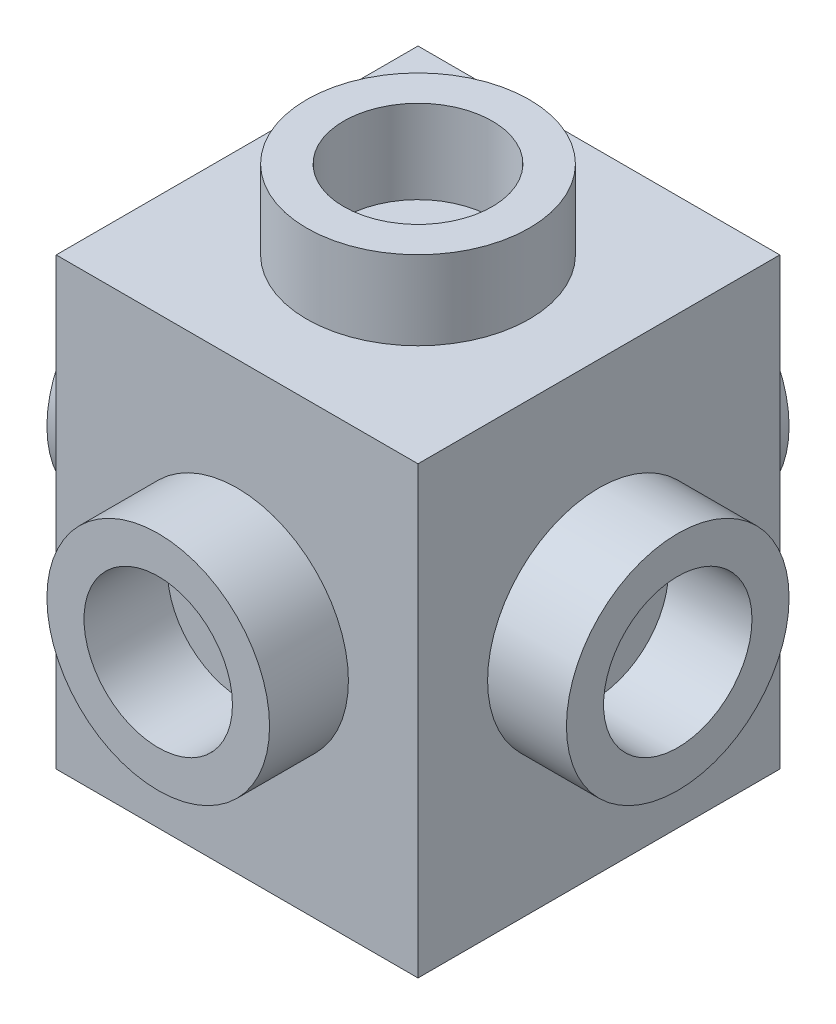
from build123d import *

# Parameters (mm, degrees)
SKETCH_1_W          = 7.8
SKETCH_1_H          = 7.8
EXTRUDE_1_DEPTH     = 9.6
SKETCH_2_R          = 2.4
EXTRUDE_2_DEPTH     = 1.7
EXTRUDE_6_DEPTH     = 1.7
EXTRUDE_7_DEPTH     = 1.7
EXTRUDE_START       = 1.7
EXTRUDE_8_DEPTH     = 1.7
EXTRUDE_9_DEPTH     = 1.7
CUT_EXTRUDE_1_DEPTH = 1.8
SKETCH_12_R         = 1.6
CUT_EXTRUDE_2_DEPTH = 1.8
SKETCH_13_R         = 1.6
CUT_EXTRUDE_3_DEPTH = 1.8
CUT_EXTRUDE_START   = -1.8
SKETCH_14_R         = 1.6
CUT_EXTRUDE_4_DEPTH = 1.8
SKETCH_15_R         = 1.6
CUT_EXTRUDE_5_DEPTH = 1.8
SKETCH_16_R         = 1.6
CUT_EXTRUDE_6_DEPTH = 1.8


with BuildPart() as part:
    # Эскиз1 → Бобышка-Вытянуть1 (new body)
    with BuildSketch(Plane(origin=(0, 0, 0), x_dir=(1, 0, 0), z_dir=(0, 1, 0))):
        Rectangle(SKETCH_1_W, SKETCH_1_H)
    extrude(amount=EXTRUDE_1_DEPTH)

    # Эскиз2 → Бобышка-Вытянуть2 (add)
    with BuildSketch(Plane(origin=(0, 9.6, 0), x_dir=(1, 0, 0), z_dir=(0, 1, 0))):
        with Locations(Location((0, 0, 0), (0, 0, 270))):
            Circle(SKETCH_2_R)
    extrude(amount=EXTRUDE_2_DEPTH)

    # Эскиз6 → Бобышка-Вытянуть6 (add)
    with BuildSketch(Plane.XY.offset(3.9)):
        with BuildLine():
            ThreePointArc((1.5134223, 6.6626736), (0, 7.2), (-1.5134223, 6.6626736))
            Line((-1.5134223, 6.6626736), (0, 4.8))
            Line((0, 4.8), (1.5134223, 6.6626736))
        make_face()
        with BuildLine():
            Line((0, 4.8), (-1.5134223, 6.6626736))
            ThreePointArc((-1.5134223, 6.6626736), (-2.4, 4.8), (-1.5134223, 2.9373264))
            Line((-1.5134223, 2.9373264), (0, 4.8))
        make_face()
        with BuildLine():
            Line((1.5134223, 6.6626736), (0, 4.8))
            Line((0, 4.8), (1.5134223, 2.9373264))
            ThreePointArc((1.5134223, 2.9373264), (2.167050244, 3.768547994), (2.4, 4.8))
            ThreePointArc((2.4, 4.8), (2.167050244, 5.831452006), (1.5134223, 6.6626736))
        make_face()
        with BuildLine():
            Line((1.5134223, 2.9373264), (0, 4.8))
            Line((0, 4.8), (-1.5134223, 2.9373264))
            ThreePointArc((-1.5134223, 2.9373264), (0, 2.4), (1.5134223, 2.9373264))
        make_face()
    extrude(amount=EXTRUDE_6_DEPTH)

    # Эскиз7 → Бобышка-Вытянуть7 (add)
    with BuildSketch(Plane(origin=(3.9, 0, 0), x_dir=(0, 0, -1), z_dir=(1, 0, 0))):
        with BuildLine():
            ThreePointArc((1.5134223, 6.6626736), (0, 7.2), (-1.5134223, 6.6626736))
            Line((-1.5134223, 6.6626736), (0, 4.8))
            Line((0, 4.8), (1.5134223, 6.6626736))
        make_face()
        with BuildLine():
            Line((0, 4.8), (-1.5134223, 6.6626736))
            ThreePointArc((-1.5134223, 6.6626736), (-2.4, 4.8), (-1.5134223, 2.9373264))
            Line((-1.5134223, 2.9373264), (0, 4.8))
        make_face()
        with BuildLine():
            Line((1.5134223, 6.6626736), (0, 4.8))
            Line((0, 4.8), (1.5134223, 2.9373264))
            ThreePointArc((1.5134223, 2.9373264), (2.167050244, 3.768547994), (2.4, 4.8))
            ThreePointArc((2.4, 4.8), (2.167050244, 5.831452006), (1.5134223, 6.6626736))
        make_face()
        with BuildLine():
            Line((1.5134223, 2.9373264), (0, 4.8))
            Line((0, 4.8), (-1.5134223, 2.9373264))
            ThreePointArc((-1.5134223, 2.9373264), (0, 2.4), (1.5134223, 2.9373264))
        make_face()
    extrude(amount=EXTRUDE_7_DEPTH)

    # Эскиз9 → Бобышка-Вытянуть8 (add)
    with BuildSketch(Plane(origin=(0, 0, -3.9), x_dir=(-1, 0, 0), z_dir=(0, 0, -1)).offset(EXTRUDE_START)):
        with BuildLine():
            ThreePointArc((1.5134223, 6.6626736), (0, 7.2), (-1.5134223, 6.6626736))
            Line((-1.5134223, 6.6626736), (0, 4.8))
            Line((0, 4.8), (1.5134223, 6.6626736))
        make_face()
        with BuildLine():
            Line((0, 4.8), (-1.5134223, 6.6626736))
            ThreePointArc((-1.5134223, 6.6626736), (-2.4, 4.8), (-1.5134223, 2.9373264))
            Line((-1.5134223, 2.9373264), (0, 4.8))
        make_face()
        with BuildLine():
            Line((1.5134223, 6.6626736), (0, 4.8))
            Line((0, 4.8), (1.5134223, 2.9373264))
            ThreePointArc((1.5134223, 2.9373264), (2.167050244, 3.768547994), (2.4, 4.8))
            ThreePointArc((2.4, 4.8), (2.167050244, 5.831452006), (1.5134223, 6.6626736))
        make_face()
        with BuildLine():
            Line((1.5134223, 2.9373264), (0, 4.8))
            Line((0, 4.8), (-1.5134223, 2.9373264))
            ThreePointArc((-1.5134223, 2.9373264), (0, 2.4), (1.5134223, 2.9373264))
        make_face()
    extrude(amount=-EXTRUDE_8_DEPTH)

    # Эскиз10 → Бобышка-Вытянуть9 (add)
    with BuildSketch(Plane.ZY.offset(3.9).offset(EXTRUDE_START)):
        with BuildLine():
            ThreePointArc((1.5134223, 6.6626736), (0, 7.2), (-1.5134223, 6.6626736))
            Line((-1.5134223, 6.6626736), (0, 4.8))
            Line((0, 4.8), (1.5134223, 6.6626736))
        make_face()
        with BuildLine():
            Line((0, 4.8), (-1.5134223, 6.6626736))
            ThreePointArc((-1.5134223, 6.6626736), (-2.4, 4.8), (-1.5134223, 2.9373264))
            Line((-1.5134223, 2.9373264), (0, 4.8))
        make_face()
        with BuildLine():
            Line((1.5134223, 6.6626736), (0, 4.8))
            Line((0, 4.8), (1.5134223, 2.9373264))
            ThreePointArc((1.5134223, 2.9373264), (2.167050244, 3.768547994), (2.4, 4.8))
            ThreePointArc((2.4, 4.8), (2.167050244, 5.831452006), (1.5134223, 6.6626736))
        make_face()
        with BuildLine():
            Line((1.5134223, 2.9373264), (0, 4.8))
            Line((0, 4.8), (-1.5134223, 2.9373264))
            ThreePointArc((-1.5134223, 2.9373264), (0, 2.4), (1.5134223, 2.9373264))
        make_face()
    extrude(amount=-EXTRUDE_9_DEPTH)

    # Эскиз11 → Вырез-Вытянуть1 (cut)
    with BuildSketch(Plane.XZ):
        with BuildLine():
            ThreePointArc((1.767766953, 1.767766953), (0, 2.5), (-1.767766953, 1.767766953))
            Line((-1.767766953, 1.767766953), (0, 0))
            Line((0, 0), (1.767766953, 1.767766953))
        make_face()
        with BuildLine():
            Line((0, 0), (-1.767766953, 1.767766953))
            ThreePointArc((-1.767766953, 1.767766953), (-2.5, 0), (-1.767766953, -1.767766953))
            Line((-1.767766953, -1.767766953), (0, 0))
        make_face()
        with BuildLine():
            Line((1.767766953, 1.767766953), (0, 0))
            Line((0, 0), (1.767766953, -1.767766953))
            ThreePointArc((1.767766953, -1.767766953), (2.309698831, -0.956708581), (2.5, 0))
            ThreePointArc((2.5, 0), (2.309698831, 0.956708581), (1.767766953, 1.767766953))
        make_face()
        with BuildLine():
            Line((1.767766953, -1.767766953), (0, 0))
            Line((0, 0), (-1.767766953, -1.767766953))
            ThreePointArc((-1.767766953, -1.767766953), (0, -2.5), (1.767766953, -1.767766953))
        make_face()
    extrude(amount=-CUT_EXTRUDE_1_DEPTH, mode=Mode.SUBTRACT)

    # Эскиз12 → Вырез-Вытянуть2 (cut)
    with BuildSketch(Plane.XY.offset(5.6)):
        with Locations((0, 4.8)):
            Circle(SKETCH_12_R)
    extrude(amount=-CUT_EXTRUDE_2_DEPTH, mode=Mode.SUBTRACT)

    # Эскиз13 → Вырез-Вытянуть3 (cut)
    with BuildSketch(Plane.ZY.offset(5.6)):
        with Locations((0, 4.8)):
            Circle(SKETCH_13_R)
    extrude(amount=-CUT_EXTRUDE_3_DEPTH, mode=Mode.SUBTRACT)

    # Эскиз14 → Вырез-Вытянуть4 (cut)
    with BuildSketch(Plane(origin=(0, 0, -5.6), x_dir=(-1, 0, 0), z_dir=(0, 0, -1)).offset(CUT_EXTRUDE_START)):
        with Locations(Location((0, 4.8, 0), (0, 0, 180))):
            Circle(SKETCH_14_R)
    extrude(amount=CUT_EXTRUDE_4_DEPTH, mode=Mode.SUBTRACT)

    # Эскиз15 → Вырез-Вытянуть5 (cut)
    with BuildSketch(Plane(origin=(5.6, 0, 0), x_dir=(0, 0, -1), z_dir=(1, 0, 0)).offset(CUT_EXTRUDE_START)):
        with Locations(Location((0, 4.8, 0), (0, 0, 180))):
            Circle(SKETCH_15_R)
    extrude(amount=CUT_EXTRUDE_5_DEPTH, mode=Mode.SUBTRACT)

    # Эскиз16 → Вырез-Вытянуть6 (cut)
    with BuildSketch(Plane(origin=(0, 11.3, 0), x_dir=(1, 0, 0), z_dir=(0, 1, 0))):
        with Locations(Location((0, 0, 0), (0, 0, 270))):
            Circle(SKETCH_16_R)
    extrude(amount=-CUT_EXTRUDE_6_DEPTH, mode=Mode.SUBTRACT)


solid = part.part
